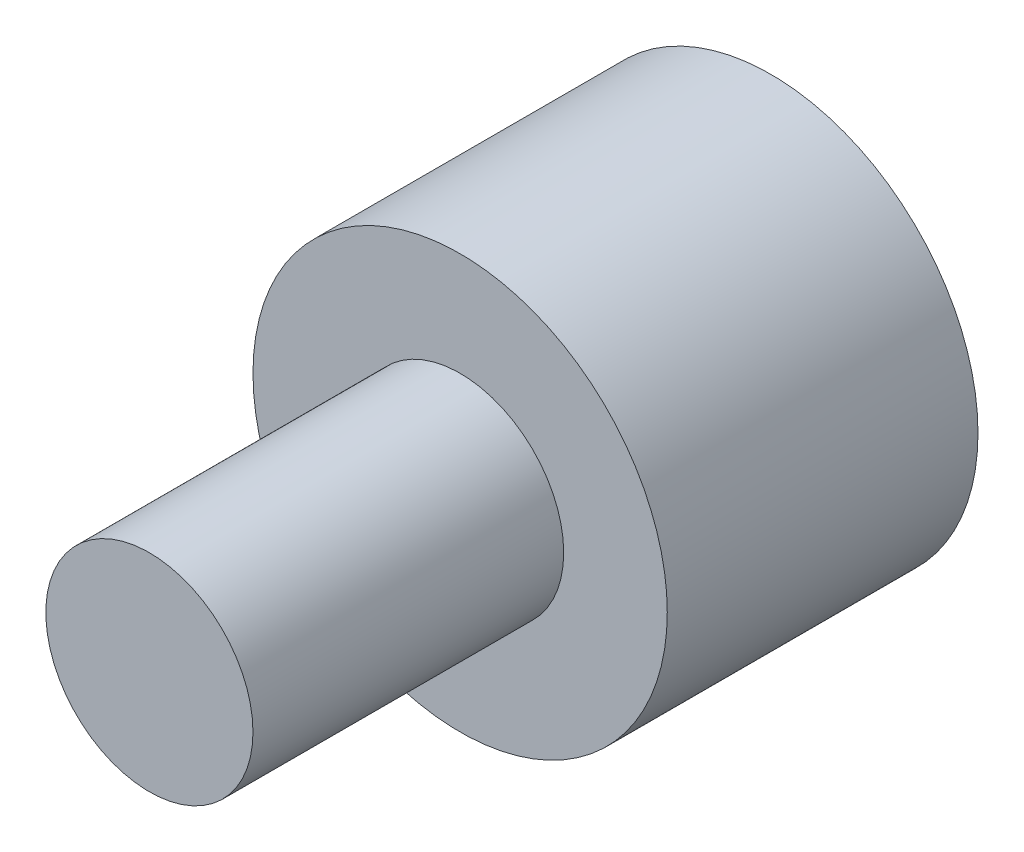
from build123d import *

# Parameters (mm, degrees)
SKETCH1_R           = 20
BOSS_EXTRUDE1_DEPTH = 30
SKETCH2_R           = 10
BOSS_EXTRUDE2_DEPTH = 30


with BuildPart() as part:
    # Sketch1 → Boss-Extrude1 (new body)
    with BuildSketch(Plane.XY):
        Circle(SKETCH1_R)
    extrude(amount=BOSS_EXTRUDE1_DEPTH)

    # Sketch2 → Boss-Extrude2 (add)
    with BuildSketch(Plane.XY.offset(30)):
        Circle(SKETCH2_R)
    extrude(amount=BOSS_EXTRUDE2_DEPTH)


solid = part.part
